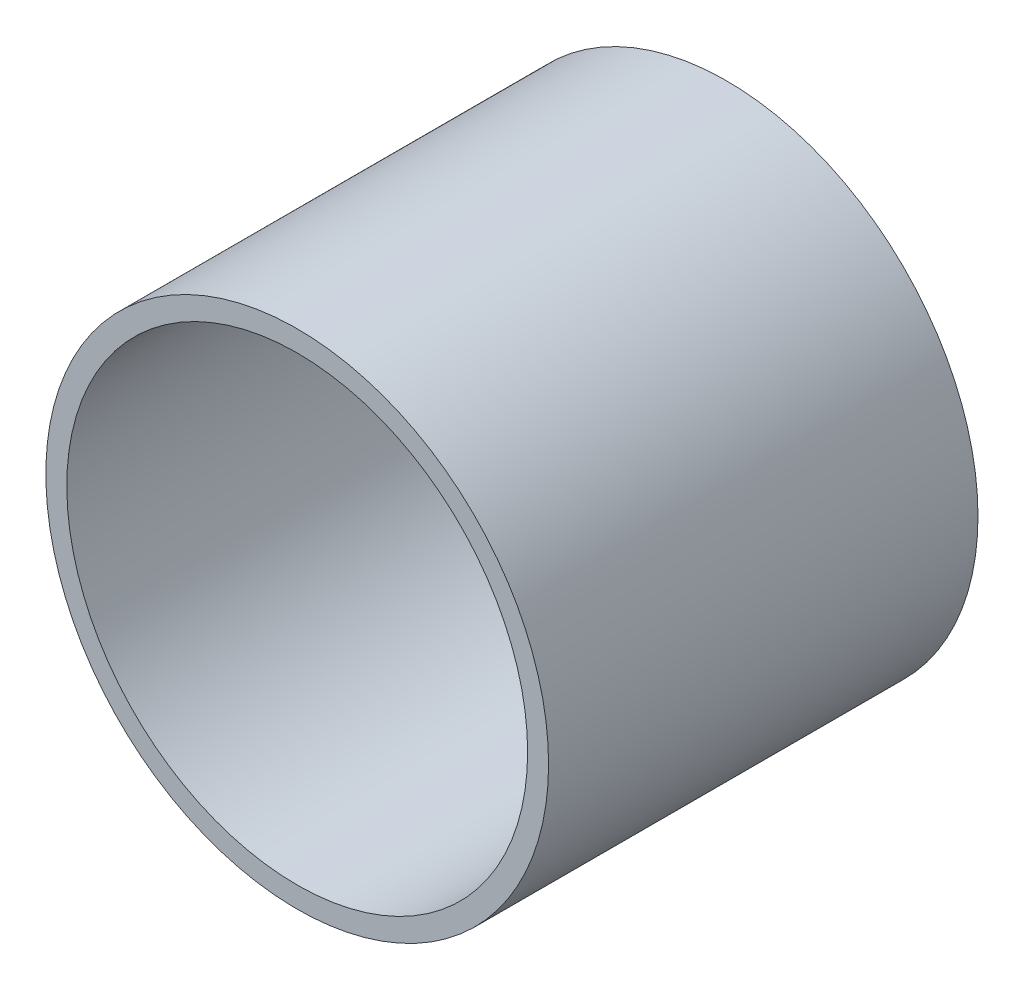
from build123d import *

# Parameters (mm, degrees)
SKETCH1_R           = 60.96
SKETCH1_R_2         = 55.88
BOSS_EXTRUDE1_DEPTH = 104.14
SKETCH2_R           = 3.3782
BOSS_EXTRUDE2_DEPTH = 6.35
CIRPATTERN1_COUNT   = 4


with BuildPart() as part:
    # Sketch1 → Boss-Extrude1 (new body)
    with BuildSketch(Plane.XY):
        Circle(SKETCH1_R)
        Circle(SKETCH1_R_2, mode=Mode.SUBTRACT)
    extrude(amount=BOSS_EXTRUDE1_DEPTH)

    # Sketch2 → Boss-Extrude2 (add)
    with BuildSketch(Plane(origin=(0, 0, 0), x_dir=(-1, 0, 0), z_dir=(0, 0, -1))):
        with BuildLine():
            Line((-48.26, 7.62), (-55.358016583, 7.62))
            ThreePointArc((-55.358016583, 7.62), (-55.88, 0), (-55.358016583, -7.62))
            Line((-55.358016583, -7.62), (-48.26, -7.62))
            ThreePointArc((-48.26, -7.62), (-40.64, 0), (-48.26, 7.62))
        make_face()
        with Locations((-48.26, 0)):
            Circle(SKETCH2_R, mode=Mode.SUBTRACT)
    boss_extrude2 = extrude(amount=-BOSS_EXTRUDE2_DEPTH)

    # CirPattern1: Boss-Extrude2 ×4 about axis
    cirpattern1_axis = Axis((0, 0, 0), (0, 0, 1))
    for i in range(1, CIRPATTERN1_COUNT):
        add(boss_extrude2.rotate(cirpattern1_axis, i * 360 / CIRPATTERN1_COUNT))


solid = part.part
